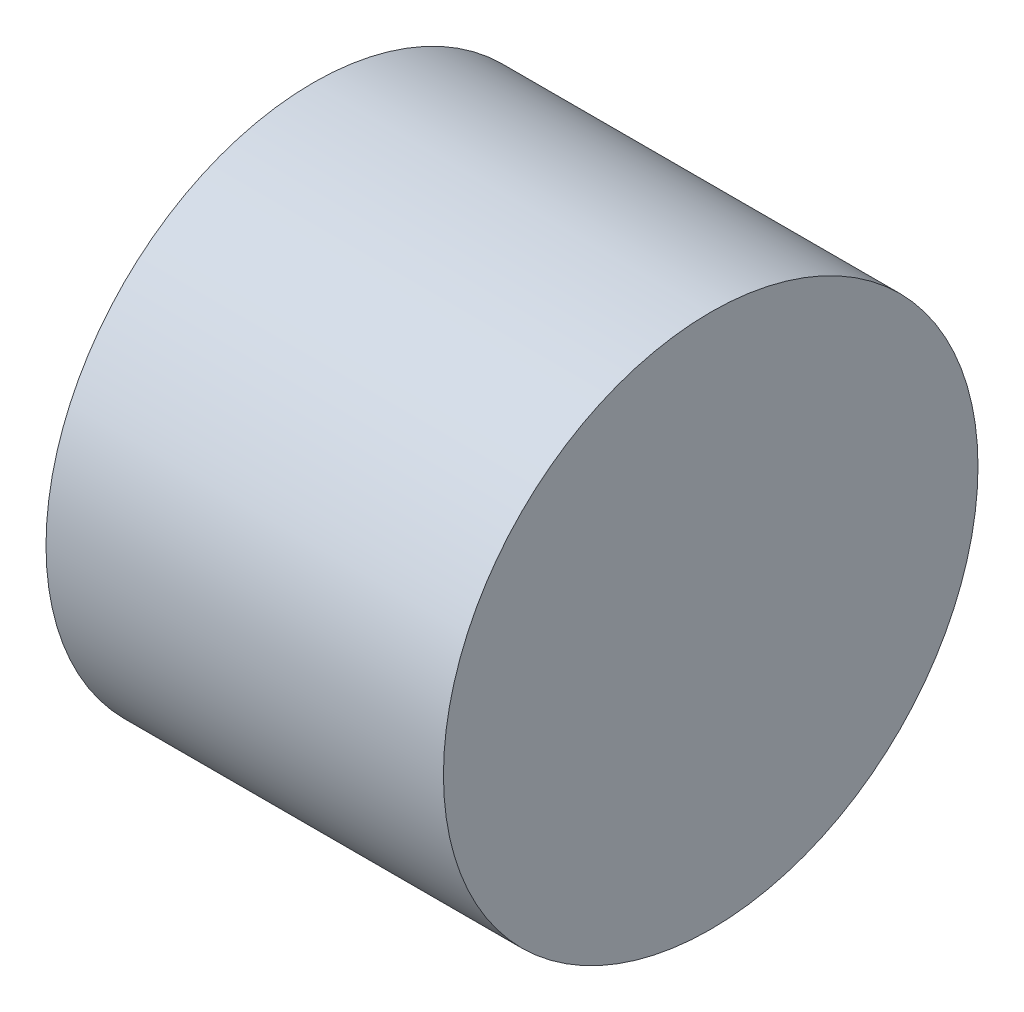
from build123d import *


with BuildPart() as part:
    # Leg_Stop_Plug Sketch → Leg_Stop_Plug (revolve)
    with BuildSketch(Plane.XY):
        Polygon((1090, 9), (1090, 13.45), (1110, 13.45), (1110, 0), (1104, 0), (1104, 9), align=None)
    revolve(axis=Axis((-3000, 0, 0), (1, 0, 0)))


solid = part.part
